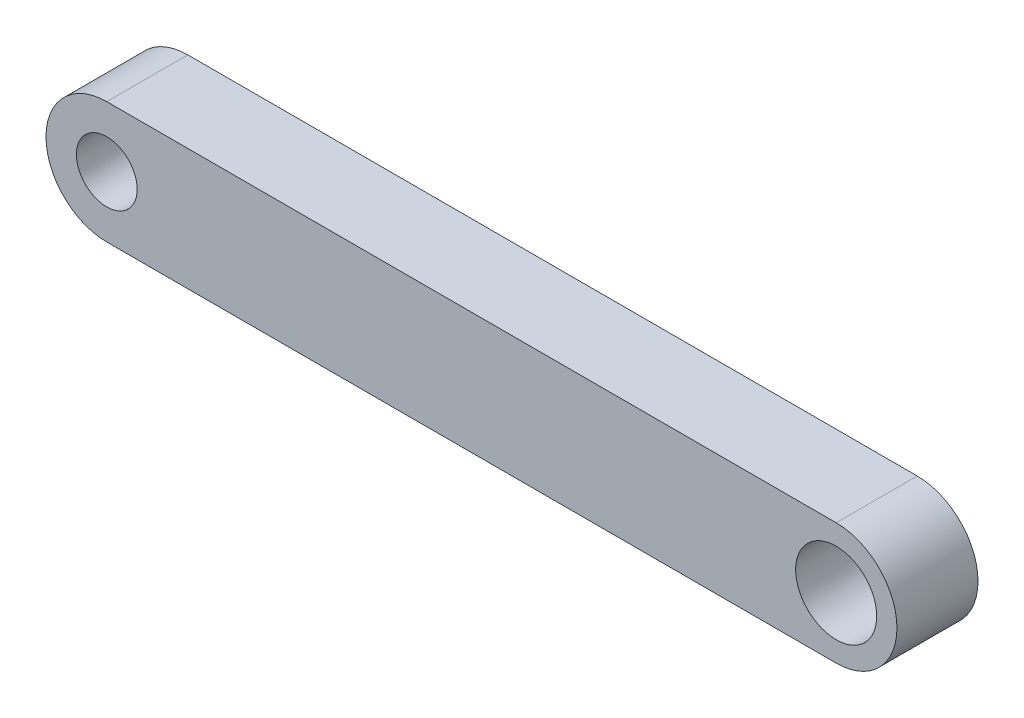
from build123d import *

# Parameters (mm, degrees)
SKETCH1_R           = 2
SKETCH1_R_2         = 1.5
BOSS_EXTRUDE1_DEPTH = 4


with BuildPart() as part:
    # Sketch1 → Boss-Extrude1 (new body)
    with BuildSketch(Plane.XY):
        with BuildLine():
            Line((0, 3), (-36, 3))
            ThreePointArc((-36, 3), (-39, 0), (-36, -3))
            Line((-36, -3), (0, -3))
            ThreePointArc((0, -3), (3, 0), (0, 3))
        make_face()
        Circle(SKETCH1_R, mode=Mode.SUBTRACT)
        with Locations((-36, 0)):
            Circle(SKETCH1_R_2, mode=Mode.SUBTRACT)
    extrude(amount=BOSS_EXTRUDE1_DEPTH)


solid = part.part
